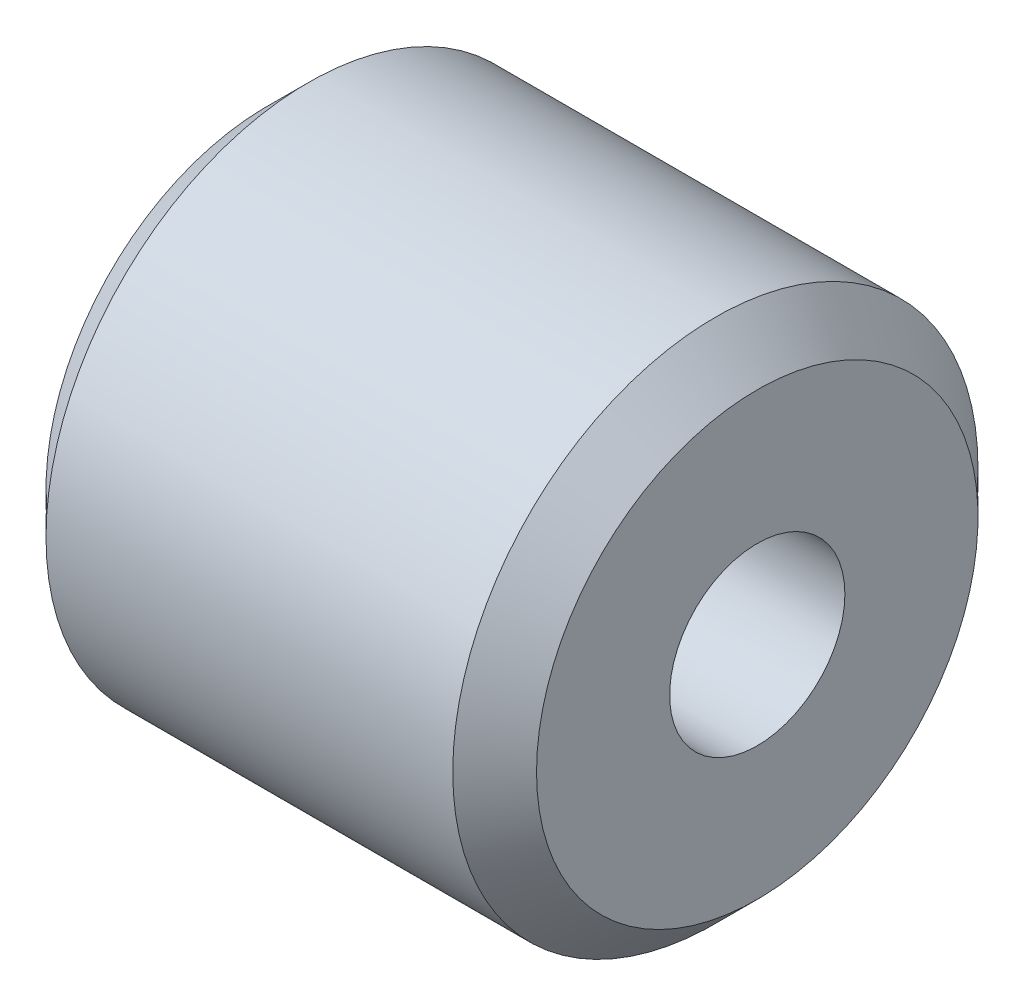
from build123d import *

# Parameters (mm, degrees)
SKETCH1_R           = 4.765
SKETCH1_R_2         = 1.59
BOSS_EXTRUDE1_DEPTH = 4.45
CHAMFER2_SIZE       = 0.76


with BuildPart() as part:
    # Sketch1 → Boss-Extrude1 (new, symmetric)
    with BuildSketch(Plane(origin=(0, 0, 0), x_dir=(0, 0, -1), z_dir=(1, 0, 0))):
        Circle(SKETCH1_R)
        Circle(SKETCH1_R_2, mode=Mode.SUBTRACT)
    extrude(amount=BOSS_EXTRUDE1_DEPTH, both=True)

    # Chamfer2
    chamfer2_edges = [part.edges().sort_by_distance(p)[0] for p in [
        (-4.45, 0, 4.765),
        (4.45, 0, 4.765),
    ]]
    chamfer(chamfer2_edges, length=CHAMFER2_SIZE)


solid = part.part
